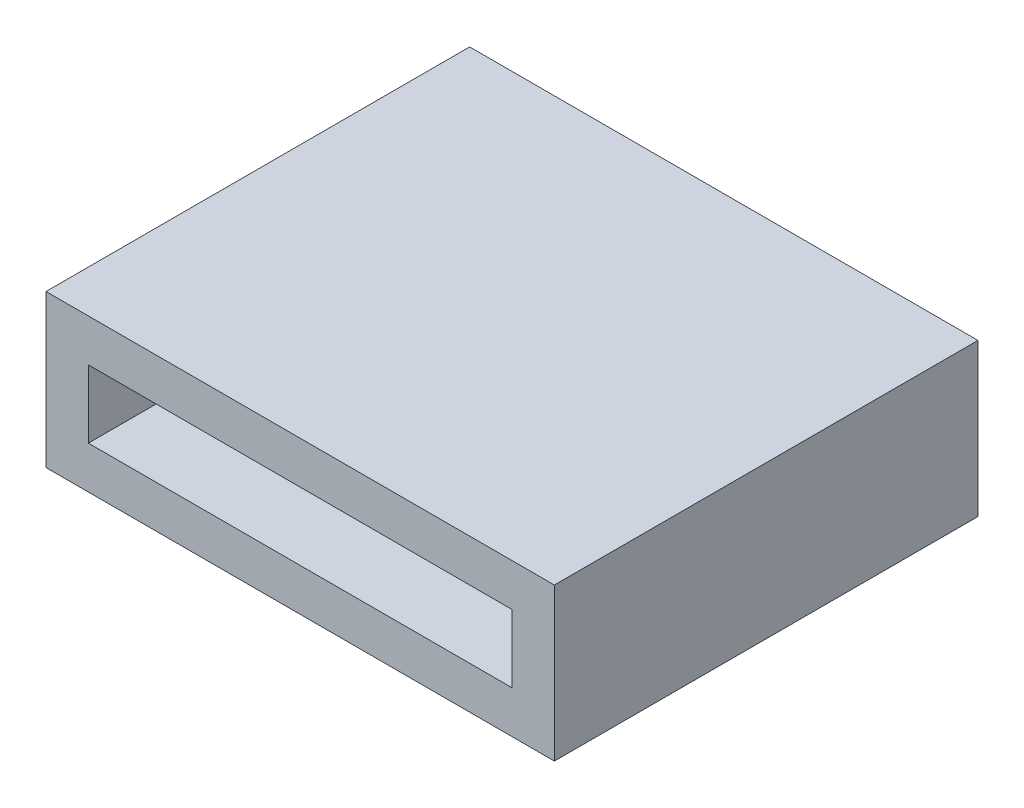
from build123d import *

# Parameters (mm, degrees)
SKETCH_1_W      = 60
SKETCH_1_H      = 18
SKETCH_1_W_2    = 50
SKETCH_1_H_2    = 8
EXTRUDE_1_DEPTH = 50
SKETCH_2_W      = 50
SKETCH_2_H      = 8
EXTRUDE_2_DEPTH = 0.5


with BuildPart() as part:
    # 스케치1 → 보스-돌출1 (new body)
    with BuildSketch(Plane.XY):
        with Locations((25, 4)):
            Rectangle(SKETCH_1_W, SKETCH_1_H)
        with Locations((25, 4)):
            Rectangle(SKETCH_1_W_2, SKETCH_1_H_2, mode=Mode.SUBTRACT)
    extrude(amount=EXTRUDE_1_DEPTH)

    # 스케치2 → 보스-돌출2 (add, symmetric)
    with BuildSketch(Plane.XY.offset(25)):
        with Locations((25, 4)):
            Rectangle(SKETCH_2_W, SKETCH_2_H)
    extrude(amount=EXTRUDE_2_DEPTH, both=True)


solid = part.part
